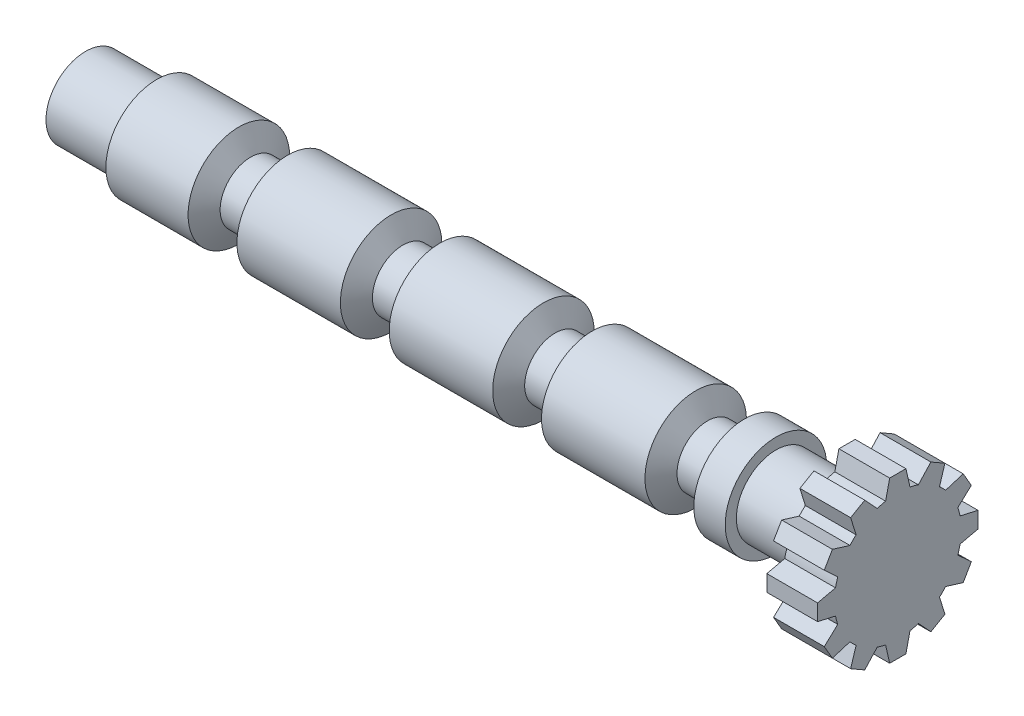
from build123d import *

# Parameters (mm, degrees)
CUT_EXTRUDE2_START  = -7
SKETCH4_R           = 5
SKETCH4_R_2         = 3.9
CUT_EXTRUDE2_DEPTH  = 7
SKETCH3_R           = 5
SKETCH3_R_2         = 3.9
CUT_EXTRUDE4_DEPTH  = 12
SKETCH7_R           = 6.25
BOSS_EXTRUDE1_DEPTH = 5
BOSS_EXTRUDE2_DEPTH = 5
CIRPATTERN1_COUNT   = 12


with BuildPart() as part:
    # Sketch2 → Revolve1 (revolve)
    with BuildSketch(Plane(origin=(0, 0, 0), x_dir=(1, 0, 0), z_dir=(0, 1, 0))):
        Polygon((40, -5), (-40, -5), (-40, 0), (-30.049059985, 0), (-24.904700538, 0), (-23.75, -2), (-21.25, -2), (-20.095299462, 0), (-9.904700538, 0), (-8.75, -2), (-6.25, -2), (-5.095299462, 0), (5.095299462, 0), (6.25, -2), (8.75, -2), (9.904700538, 0), (20.095299462, 0), (21.25, -2), (23.75, -2), (24.904700538, 0), (30.049059985, 0), (40, 0), align=None)
    revolve(axis=Axis((40, 0, 5), (-1, 0, 0)))

    # Sketch4 → Cut-Extrude2 (cut)
    with BuildSketch(Plane.ZY.offset(40).offset(CUT_EXTRUDE2_START)):
        with Locations(Location((5, 0, 0), (0, 0, 180))):
            Circle(SKETCH4_R)
        with Locations((5, 0)):
            Circle(SKETCH4_R_2, mode=Mode.SUBTRACT)
    extrude(amount=CUT_EXTRUDE2_DEPTH, mode=Mode.SUBTRACT)

    # Sketch3 → Cut-Extrude4 (cut)
    with BuildSketch(Plane(origin=(40, 0, 0), x_dir=(0, 0, -1), z_dir=(1, 0, 0))):
        with Locations((-5, 0)):
            Circle(SKETCH3_R)
        with Locations(Location((-5, 0, 0), (0, 0, 180))):
            Circle(SKETCH3_R_2, mode=Mode.SUBTRACT)
    extrude(amount=-CUT_EXTRUDE4_DEPTH, mode=Mode.SUBTRACT)

    # Sketch7 → Boss-Extrude1 (add)
    with BuildSketch(Plane(origin=(40, 0, 0), x_dir=(0, 0, -1), z_dir=(1, 0, 0))):
        with Locations((-5, 0)):
            Circle(SKETCH7_R)
    extrude(amount=-BOSS_EXTRUDE1_DEPTH)

    # Sketch6 → Boss-Extrude2 (add)
    with BuildSketch(Plane(origin=(40, 0, 0), x_dir=(0, 0, -1), z_dir=(1, 0, 0))):
        Polygon((-5.8, 7.9), (-4.2, 7.9), (-3.7, 5.7), (-6.3, 5.7), align=None)
    boss_extrude2 = extrude(amount=-BOSS_EXTRUDE2_DEPTH)

    # CirPattern1: Boss-Extrude2 ×12 about axis
    cirpattern1_axis = Axis((0, 0, 5), (1, 0, 0))
    for i in range(1, CIRPATTERN1_COUNT):
        add(boss_extrude2.rotate(cirpattern1_axis, i * 360 / CIRPATTERN1_COUNT))


solid = part.part
